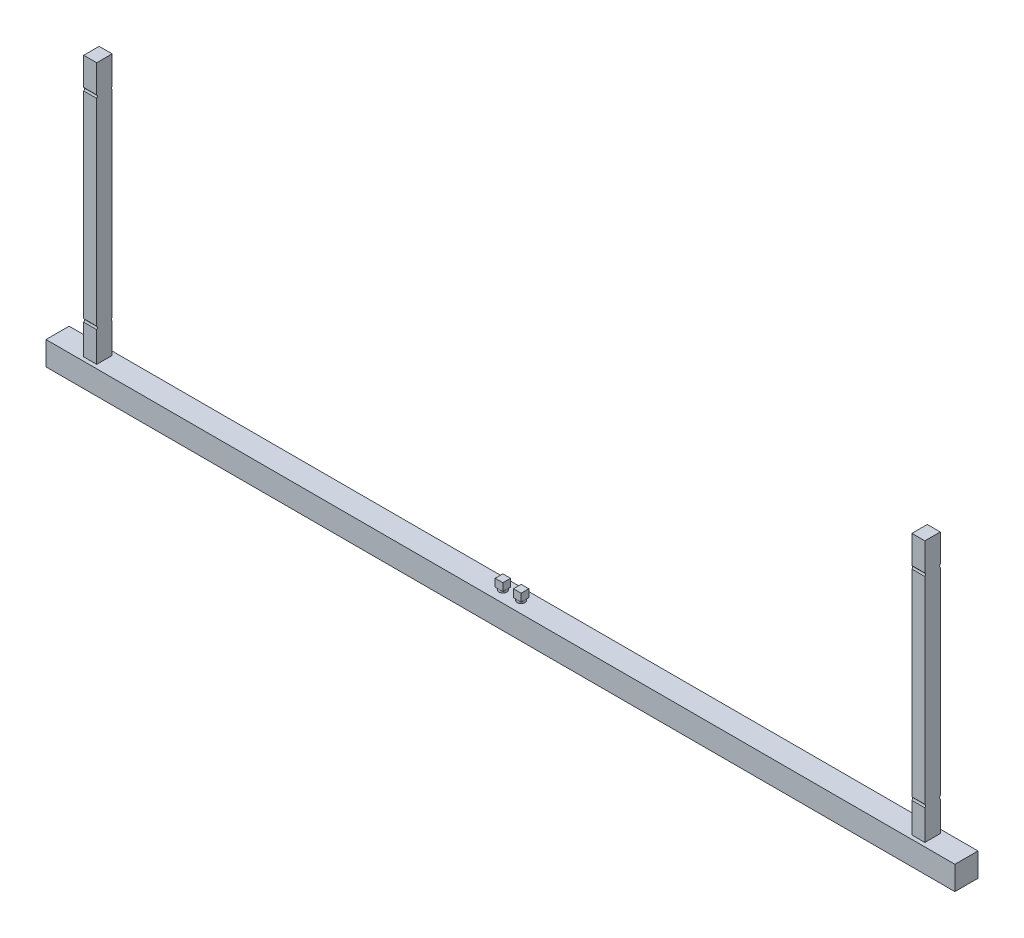
from build123d import *

# Parameters (mm, degrees)
ESBO_O1_W                = 5900
ESBO_O1_H                = 154
RESSALTO_EXTRUS_O1_DEPTH = 150
ESBO_O3_W                = 84.24
ESBO_O3_H                = 100
RESSALTO_EXTRUS_O2_DEPTH = 1849.72
ESBO_O4_R                = 12.892389556
ESBO_O4_R_2              = 12.89
CORTE_EXTRUS_O2_DEPTH    = 6185.978906868
ESBO_O5_R                = 25
RESSALTO_EXTRUS_O3_DEPTH = 170
ESBO_O7_W                = 50
ESBO_O7_H                = 50
RESSALTO_EXTRUS_O4_DEPTH = 50


with BuildPart() as part:
    # Esboço1 → Ressalto-extrusão1 (new body)
    with BuildSketch(Plane.XY):
        with Locations((2950, 77)):
            Rectangle(ESBO_O1_W, ESBO_O1_H)
    extrude(amount=RESSALTO_EXTRUS_O1_DEPTH)

    # Esboço3 → Ressalto-extrusão2 (add)
    with BuildSketch(Plane(origin=(0, 0, 0), x_dir=(1, 0, 0), z_dir=(0, 1, 0))):
        with Locations((5637.88, -75)):
            Rectangle(ESBO_O3_W, ESBO_O3_H)
        with Locations((262.12, -75)):
            Rectangle(ESBO_O3_W, ESBO_O3_H)
    extrude(amount=RESSALTO_EXTRUS_O2_DEPTH)

    # Esboço4 → Corte-extrusão2 (cut, through all)
    with BuildSketch(Plane(origin=(0, 0, 0), x_dir=(0, 0, -1), z_dir=(1, 0, 0))):
        with Locations((-16.489271988, 1658.94)):
            Circle(ESBO_O4_R)
        with Locations((-133.510728012, 1658.94)):
            Circle(ESBO_O4_R)
        with Locations((-16.489271988, 358.9)):
            Circle(ESBO_O4_R_2)
        with Locations((-133.510728012, 358.9)):
            Circle(ESBO_O4_R_2)
    extrude(amount=CORTE_EXTRUS_O2_DEPTH, mode=Mode.SUBTRACT)

    # Esboço5 → Ressalto-extrusão3 (add)
    with BuildSketch(Plane(origin=(0, 0, 0), x_dir=(1, 0, 0), z_dir=(0, 1, 0))):
        with Locations(Location((3008.955824922, -75, 0), (0, 0, 90))):
            Circle(ESBO_O5_R)
        with Locations(Location((2891.044175078, -75, 0), (0, 0, 90))):
            Circle(ESBO_O5_R)
    extrude(amount=RESSALTO_EXTRUS_O3_DEPTH)

    # Esboço7 → Ressalto-extrusão4 (add)
    with BuildSketch(Plane(origin=(0, 170, 0), x_dir=(1, 0, 0), z_dir=(0, 1, 0))):
        with Locations((3009.175695641, -74.98317061)):
            Rectangle(ESBO_O7_W, ESBO_O7_H)
        with Locations((2890.947304084, -75.264284294)):
            Rectangle(ESBO_O7_W, ESBO_O7_H)
    extrude(amount=RESSALTO_EXTRUS_O4_DEPTH)


solid = part.part
